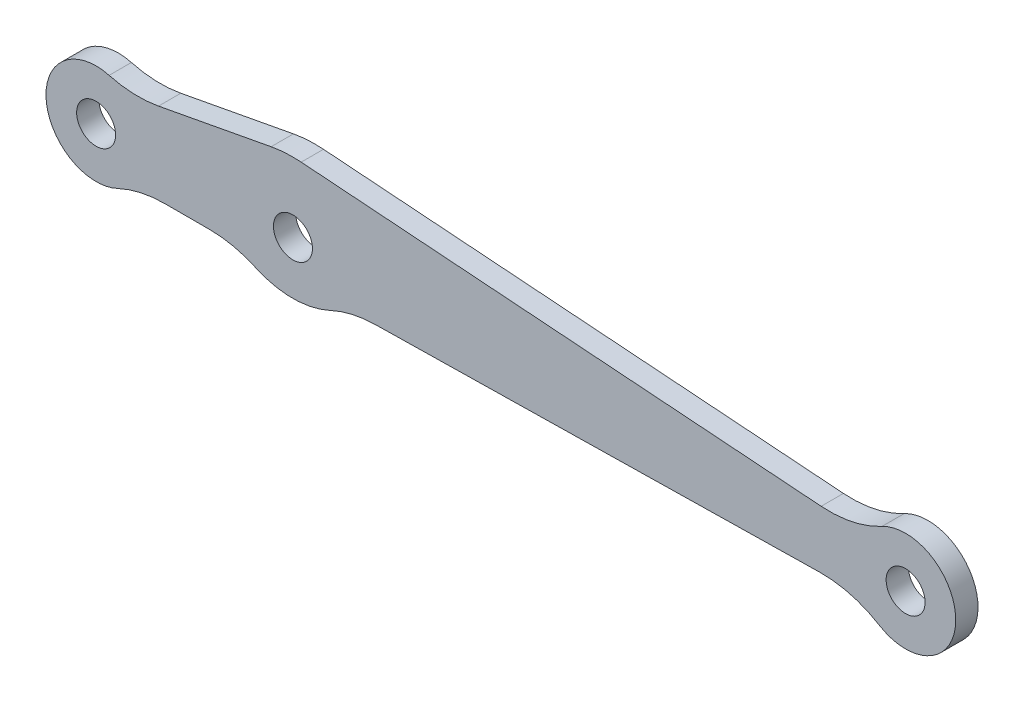
from build123d import *

# Parameters (mm, degrees)
SKETCH1_R           = 1.75
BOSS_EXTRUDE1_DEPTH = 2


with BuildPart() as part:
    # Sketch1 → Boss-Extrude1 (new body)
    with BuildSketch(Plane.XY):
        with BuildLine():
            Line((-1.959177489, 6.07006951), (-12.067534954, 4.175209114))
            ThreePointArc((-12.067534954, 4.175209114), (-14.294918054, 4.01142257), (-16.503100774, 4.346072502))
            ThreePointArc((-16.503100774, 4.346072502), (-22.152448054, -0.397063522), (-15.757299357, -4.073275862))
            ThreePointArc((-15.757299357, -4.073275862), (-13.684324334, -3.364947711), (-11.506853482, -3.125))
            Line((-11.506853482, -3.125), (-7.49859406, -3.125))
            ThreePointArc((-7.49859406, -3.125), (-5.373977874, -3.353305875), (-3.34637416, -4.027798787))
            ThreePointArc((-3.34637416, -4.027798787), (0, -4.75), (3.341869686, -4.007233812))
            ThreePointArc((3.341869686, -4.007233812), (5.310275247, -3.332763669), (7.375648406, -3.080248053))
            Line((7.375648406, -3.080248053), (47.281791607, -2.38455359))
            ThreePointArc((47.281791607, -2.38455359), (50.073909506, -2.731761792), (52.658788971, -3.843010658))
            ThreePointArc((52.658788971, -3.843010658), (59.498304049, -0.123534147), (52.873235099, 3.965711923))
            ThreePointArc((52.873235099, 3.965711923), (50.227695467, 2.997245413), (47.417022258, 2.8050907))
            Line((47.417022258, 2.8050907), (0.741973806, 6.221807217))
            ThreePointArc((0.741973806, 6.221807217), (-0.613509345, 6.233299043), (-1.959177489, 6.07006951))
        make_face()
        with Locations((-17.67, 0)):
            Circle(SKETCH1_R, mode=Mode.SUBTRACT)
        Circle(SKETCH1_R, mode=Mode.SUBTRACT)
        with Locations((55, 0)):
            Circle(SKETCH1_R, mode=Mode.SUBTRACT)
    extrude(amount=BOSS_EXTRUDE1_DEPTH)


solid = part.part
